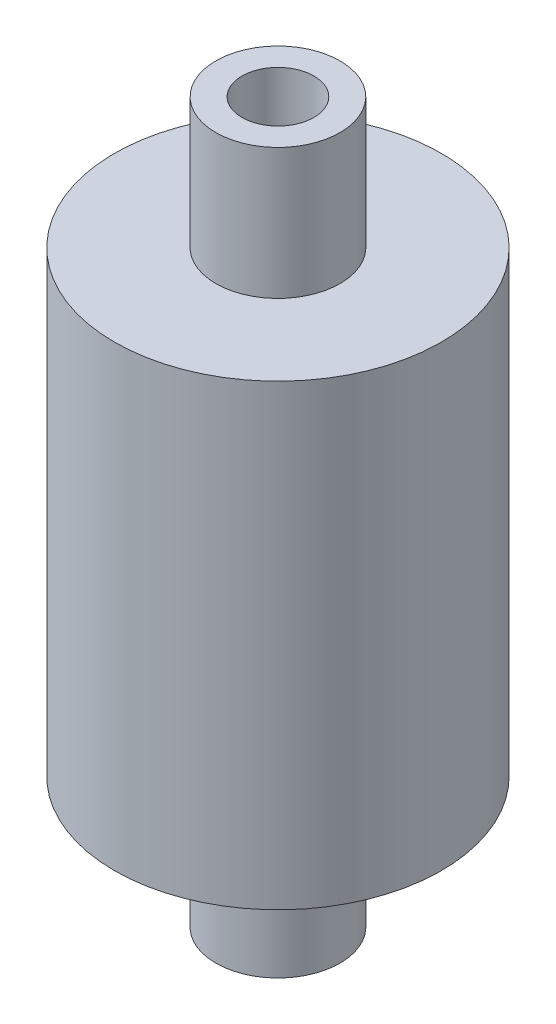
from build123d import *


with BuildPart() as part:
    # Sketch1 → Revolve1 (revolve)
    with BuildSketch(Plane(origin=(0, 0, 0), x_dir=(0, 0, -1), z_dir=(1, 0, 0))):
        Polygon((-4.75, 27.5), (-4.75, 17.5), (-12.5, 17.5), (-12.5, -17.5), (-4.75, -17.5), (-4.75, -27.5), (-2.75, -27.5), (-2.75, 27.5), align=None)
    revolve(axis=Axis((0, 59.047619048, 0), (0, -1, 0)))


solid = part.part
